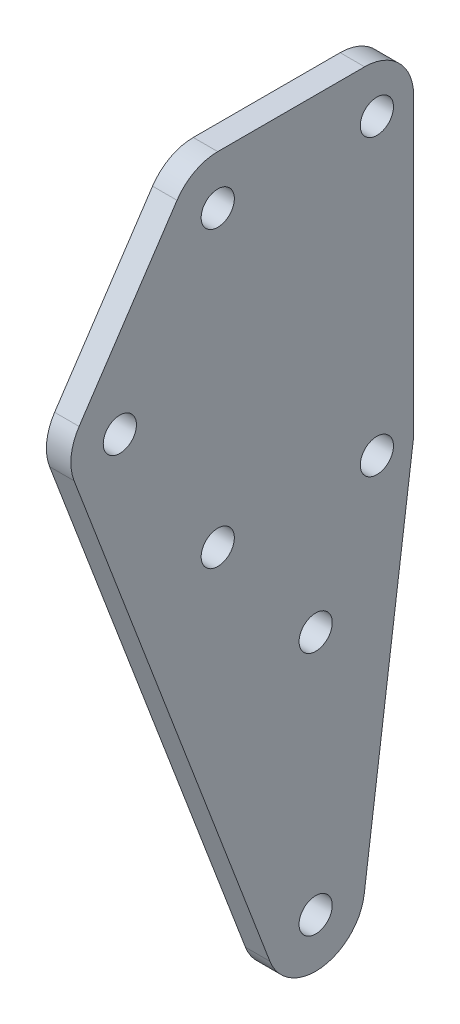
from build123d import *

# Parameters (mm, degrees)
SKETCH1_W             = 50.8
SKETCH1_H             = 101.6
BOSS_EXTRUDE1_DEPTH   = 1.5875
F_8_CLEARANCE_HOLE1_D = 4.3053
SKETCH4_W             = 64.445768018
SKETCH4_H             = 114.740745706
CUT_EXTRUDE1_DEPTH    = 3.175


with BuildPart() as part:
    # Sketch1 → Boss-Extrude1 (new, symmetric)
    with BuildSketch(Plane(origin=(0, 0, 0), x_dir=(0, 0, -1), z_dir=(1, 0, 0))):
        Rectangle(SKETCH1_W, SKETCH1_H)
    extrude(amount=BOSS_EXTRUDE1_DEPTH, both=True)

    # #8 Clearance Hole1 (through all)
    with Locations(Plane.ZY.offset(1.5875)):
        with Locations((-12.7, -41.275), (-12.7, -9.525), (-20.6375, 6.35), (0, 6.35), (12.7, 25.4), (0, 44.45), (-20.6375, 44.45)):
            Hole(F_8_CLEARANCE_HOLE1_D / 2)

    # Sketch4 → Cut-Extrude1 (cut)
    with BuildSketch(Plane.ZY.offset(1.5875)):
        Rectangle(SKETCH4_W, SKETCH4_H)
        with BuildLine():
            Line((-19.05, 50.8), (0, 50.8))
            ThreePointArc((0, 50.8), (2.996297827, 50.048633702), (5.283519369, 47.972346246))
            Line((5.283519369, 47.972346246), (17.983519369, 28.922346246))
            ThreePointArc((17.983519369, 28.922346246), (19.010206024, 26.109788659), (18.633997117, 23.13942967))
            Line((18.633997117, 23.13942967), (-6.766002883, -43.53557033))
            ThreePointArc((-6.766002883, -43.53557033), (-13.434053527, -47.582429383), (-18.994539095, -42.112423182))
            Line((-18.994539095, -42.112423182), (-25.358404321, 5.721932613))
            ThreePointArc((-25.358404321, 5.721932613), (-25.389589702, 6.03527836), (-25.4, 6.35))
            Line((-25.4, 6.35), (-25.4, 44.45))
            ThreePointArc((-25.4, 44.45), (-23.540128061, 48.940128061), (-19.05, 50.8))
        make_face(mode=Mode.SUBTRACT)
    extrude(amount=-CUT_EXTRUDE1_DEPTH, mode=Mode.SUBTRACT)


solid = part.part
